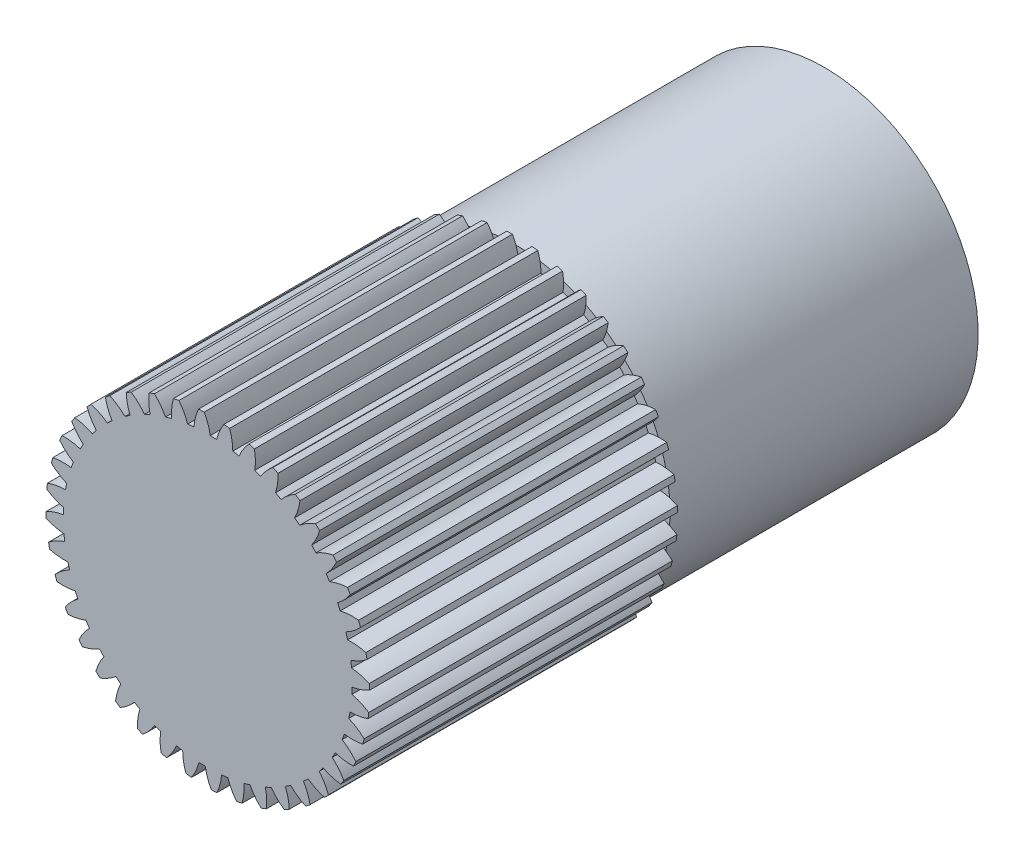
from build123d import *

# Parameters (mm, degrees)
SKETCH_1_R               = 46.875
EXTRUDE_1_DEPTH          = 100
EXTRUDE_START            = -100
EXTRUDE_2_DEPTH          = 100
PATTERN_CIRCULAR_1_COUNT = 40
SKETCH_3_R               = 50
EXTRUDE_3_DEPTH          = 100


with BuildPart() as part:
    # 草图1 → 凸台-拉伸1 (new body)
    with BuildSketch(Plane.XY):
        Circle(SKETCH_1_R)
    extrude(amount=EXTRUDE_1_DEPTH)

    # 草图2 → 凸台-拉伸2 (add)
    with BuildSketch(Plane.XY.offset(100).offset(EXTRUDE_START)):
        with BuildLine():
            ThreePointArc((-0.814128744, -46.86792954), (1.840303864, -46.838861074), (4.488834427, -46.65957555))
            ThreePointArc((4.488834427, -46.65957555), (3.98829878, -49.603341487), (2.983343604, -52.415166326))
            ThreePointArc((2.983343604, -52.415166326), (2.061140327, -52.459524403), (1.138299601, -52.487658302))
            ThreePointArc((1.138299601, -52.487658302), (-0.084170867, -49.763349255), (-0.814128744, -46.86792954))
        make_face()
    extrude_2 = extrude(amount=EXTRUDE_2_DEPTH)

    # 阵列(圆周)1: 凸台-拉伸2 ×40 about axis
    pattern_circular_1_axis = Axis((0, 0, 0), (0, 0, 1))
    for i in range(1, PATTERN_CIRCULAR_1_COUNT):
        add(extrude_2.rotate(pattern_circular_1_axis, i * 360 / PATTERN_CIRCULAR_1_COUNT))

    # 草图3 → 凸台-拉伸3 (add)
    with BuildSketch(Plane(origin=(0, 0, 0), x_dir=(-1, 0, 0), z_dir=(0, 0, -1))):
        Circle(SKETCH_3_R)
    extrude(amount=EXTRUDE_3_DEPTH)


solid = part.part
